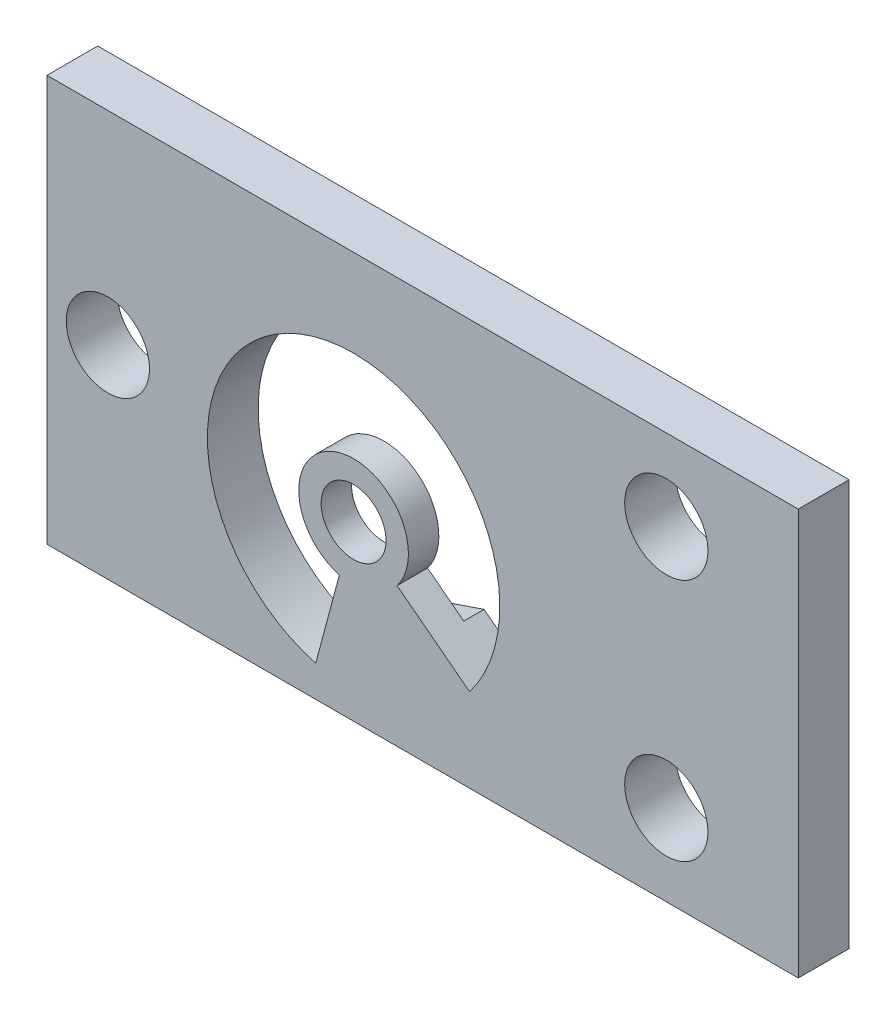
from build123d import *

# Parameters (mm, degrees)
ESQUISSE1_W             = 37
ESQUISSE1_H             = 20
ESQUISSE1_R             = 2.05
ESQUISSE1_R_2           = 1.6
BOSS_EXTRU_1_DEPTH      = 2.5
ESQUISSE3_R             = 1.6
ENL_V_MAT_EXTRU_1_DEPTH = 1
ESQUISSE5_W             = 2.5
ESQUISSE5_H             = 20
ENL_V_MAT_EXTRU_3_DEPTH = 39.408983324


with BuildPart() as part:
    # Esquisse1 → Boss.-Extru.1 (new body)
    with BuildSketch(Plane.XY):
        Rectangle(ESQUISSE1_W, ESQUISSE1_H)
        with Locations((-12, 6)):
            Circle(ESQUISSE1_R, mode=Mode.SUBTRACT)
        with Locations((-12, -6)):
            Circle(ESQUISSE1_R, mode=Mode.SUBTRACT)
        with Locations((15.5, 0)):
            Circle(ESQUISSE1_R, mode=Mode.SUBTRACT)
        with Locations((3.4, -1.5)):
            Circle(ESQUISSE1_R_2, mode=Mode.SUBTRACT)
        with BuildLine():
            Line((-2.311989303, -5.883283951), (1.258004011, -3.143731482))
            ThreePointArc((1.258004011, -3.143731482), (4.267841424, 1.056726669), (4.098811422, -4.107999731))
            Line((4.098811422, -4.107999731), (5.263497125, -8.454665949))
            ThreePointArc((5.263497125, -8.454665949), (5.714243798, 5.317937785), (-2.311989303, -5.883283951))
        make_face(mode=Mode.SUBTRACT)
    boss_extru_1 = extrude(amount=BOSS_EXTRU_1_DEPTH)

    # Esquisse3 → Enlèv. mat.-Extru.1 (cut)
    # profile 1 of 2: a face of its own
    with BuildSketch(Plane(origin=(0, 0, 0), x_dir=(-1, 0, 0), z_dir=(0, 0, -1))):
        with BuildLine():
            Line((2.311989303, -5.883283951), (-1.258004011, -3.143731482))
            ThreePointArc((-1.258004011, -3.143731482), (-4.267841424, 1.056726669), (-4.098811422, -4.107999731))
            Line((-4.098811422, -4.107999731), (-5.263497125, -8.454665949))
            ThreePointArc((-5.263497125, -8.454665949), (-5.714243798, 5.317937785), (2.311989303, -5.883283951))
        make_face()
    # profile 2 of 2: a face of its own
    with BuildSketch(Plane(origin=(0, 0, 0), x_dir=(-1, 0, 0), z_dir=(0, 0, -1))):
        with BuildLine():
            Line((-4.681154273, -6.28133284), (0.526992646, -4.513507717))
            Line((0.526992646, -4.513507717), (-1.258004011, -3.143731482))
            ThreePointArc((-1.258004011, -3.143731482), (-4.267841424, 1.056726669), (-4.098811422, -4.107999731))
            Line((-4.098811422, -4.107999731), (-4.681154273, -6.28133284))
        make_face()
        with Locations((-3.4, -1.5)):
            Circle(ESQUISSE3_R, mode=Mode.SUBTRACT)
    enl_v_mat_extru_1 = extrude(amount=-ENL_V_MAT_EXTRU_1_DEPTH, mode=Mode.SUBTRACT)

    # Symétrie1: Boss.-Extru.1, Enlèv. mat.-Extru.1 across plane
    add(boss_extru_1.mirror(Plane(origin=(18.5, 0, 0), x_dir=(0, 0, 1), z_dir=(1, 0, 0))))
    add(enl_v_mat_extru_1.mirror(Plane(origin=(18.5, 0, 0), x_dir=(0, 0, 1), z_dir=(1, 0, 0))), mode=Mode.SUBTRACT)

    # Esquisse5 → Enlèv. mat.-Extru.3 (cut, through all)
    with BuildSketch(Plane(origin=(18.5, 0, 0), x_dir=(0, 0, -1), z_dir=(1, 0, 0))):
        with Locations((-1.25, 0)):
            Rectangle(ESQUISSE5_W, ESQUISSE5_H)
    extrude(amount=-ENL_V_MAT_EXTRU_3_DEPTH, mode=Mode.SUBTRACT)


solid = part.part
